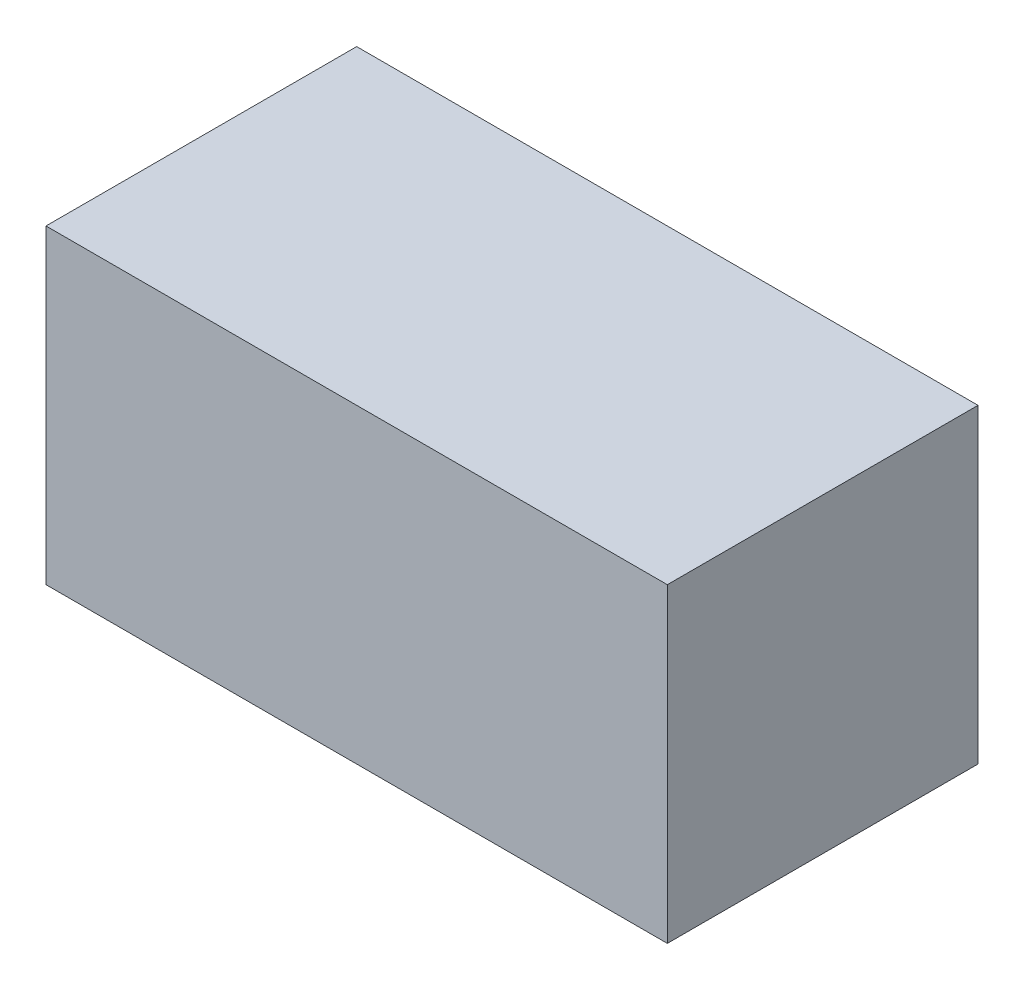
from build123d import *

# Parameters (mm, degrees)
SKETCH1_W           = 60
SKETCH1_H           = 30
BOSS_EXTRUDE1_DEPTH = 30
SKETCH4_W           = 1.5
SKETCH4_H           = 25
BOSS_EXTRUDE2_DEPTH = 28.5


with BuildPart() as part:
    # Sketch1 → Boss-Extrude1 (new body)
    with BuildSketch(Plane.XY):
        Rectangle(SKETCH1_W, SKETCH1_H)
    extrude(amount=BOSS_EXTRUDE1_DEPTH)

    # Sketch4 → Boss-Extrude2 (add)
    with BuildSketch(Plane.XY):
        with Locations((-15.375, -1)):
            Rectangle(SKETCH4_W, SKETCH4_H)
        with Locations((-20, 1)):
            Rectangle(SKETCH4_W, SKETCH4_H)
        with Locations((-24.625, -1)):
            Rectangle(SKETCH4_W, SKETCH4_H)
        with Locations((15.375, -1)):
            Rectangle(SKETCH4_W, SKETCH4_H)
        with Locations((20, 1)):
            Rectangle(SKETCH4_W, SKETCH4_H)
        with Locations((24.625, -1)):
            Rectangle(SKETCH4_W, SKETCH4_H)
    extrude(amount=BOSS_EXTRUDE2_DEPTH)


solid = part.part
